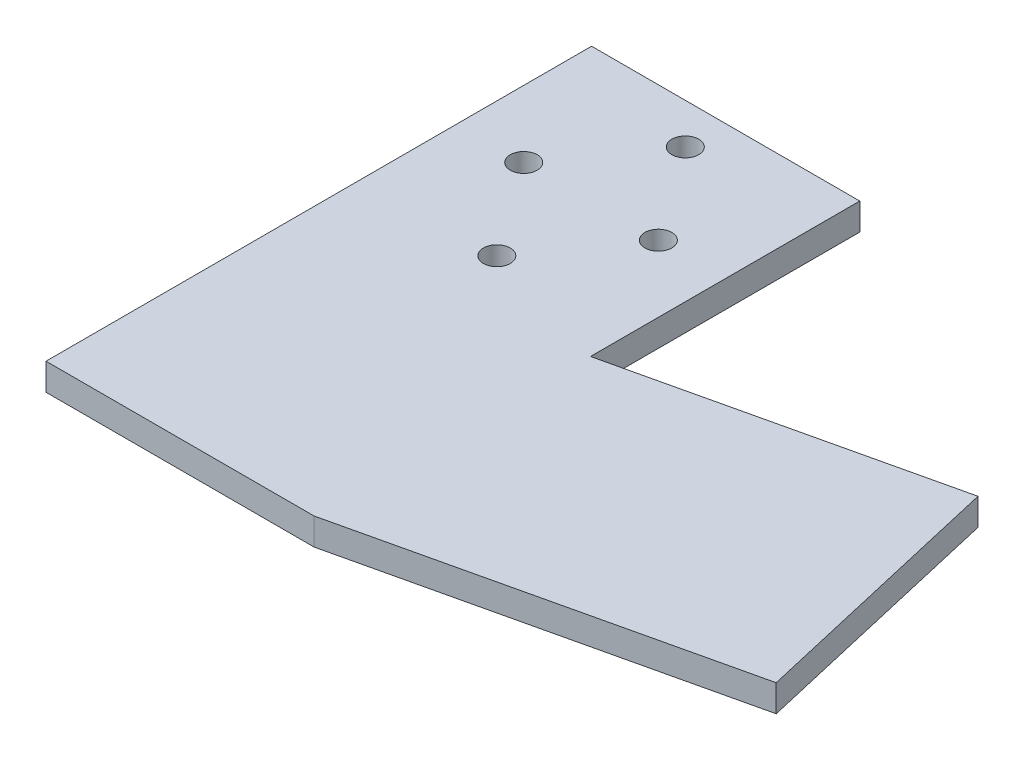
from build123d import *

# Parameters (mm, degrees)
BOSS_EXTRUDE1_DEPTH     = 5
CUT_EXTRUDE1_DEPTH      = 87.704673865
CUT_EXTRUDE1_DEPTH_BACK = 87.704673865
SKETCH2_R               = 2.5


with BuildPart() as part:
    # Sketch1 → Boss-Extrude1 (new body)
    with BuildSketch(Plane(origin=(0, 0, 0), x_dir=(1, 0, 0), z_dir=(0, 1, 0))):
        Polygon((0, 0), (58.462203887, 13.497063261), (69.709756604, -35.221439979), (0, -51.31520539), (-49.8, -51.31520539), (-49.8, 0), (-49.8, 50), (0, 50), align=None)
    extrude(amount=BOSS_EXTRUDE1_DEPTH)

    # Sketch2 → Cut-Extrude1 (cut, two sides: drawn at the far end of the back side and taken through both)
    with BuildSketch(Plane(origin=(0, 5, 0), x_dir=(1, 0, 0), z_dir=(0, 1, 0)).offset(-CUT_EXTRUDE1_DEPTH_BACK)):
        with Locations(Location((-24.9, 42.5, 0), (0, 0, 270))):
            Circle(SKETCH2_R)
        with Locations(Location((-24.9, 7.5, 0), (0, 0, 90))):
            Circle(SKETCH2_R)
        with Locations(Location((-12.4, 25, 0), (0, 0, 270))):
            Circle(SKETCH2_R)
        with Locations(Location((-37.4, 25, 0), (0, 0, 90))):
            Circle(SKETCH2_R)
    extrude(amount=CUT_EXTRUDE1_DEPTH + CUT_EXTRUDE1_DEPTH_BACK, mode=Mode.SUBTRACT)


solid = part.part
